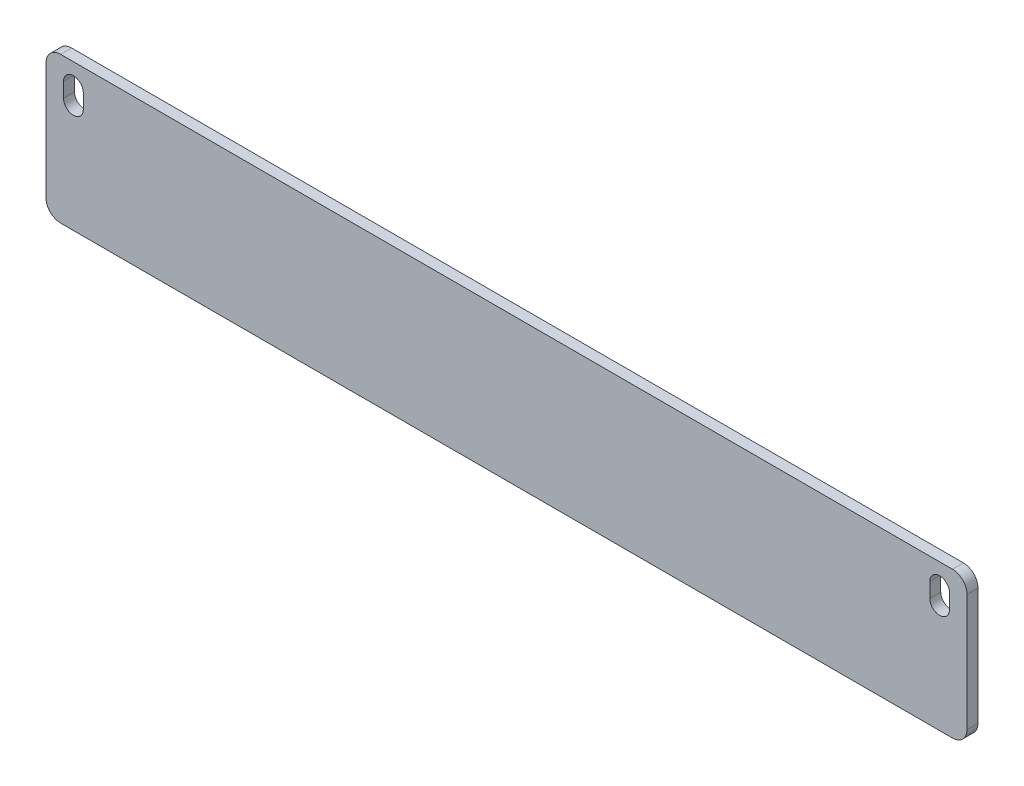
from build123d import *

# Parameters (mm, degrees)
SKETCH1_W           = 252
SKETCH1_H           = 40
BOSS_EXTRUDE1_DEPTH = 3
SKETCH2_W           = 220
SKETCH2_H           = 8
BOSS_EXTRUDE2_DEPTH = 5
FILLET1_R           = 4
FILLET2_R           = 1


with BuildPart() as part:
    # Sketch1 → Boss-Extrude1 (new body)
    with BuildSketch(Plane.XY):
        with Locations((126, 20)):
            Rectangle(SKETCH1_W, SKETCH1_H)
        with BuildLine():
            Line((10.2, 34), (10.2, 30))
            ThreePointArc((10.2, 30), (7.5, 27.3), (4.8, 30))
            Line((4.8, 30), (4.8, 34))
            ThreePointArc((4.8, 34), (7.5, 36.7), (10.2, 34))
        make_face(mode=Mode.SUBTRACT)
        with BuildLine():
            Line((247.2, 34), (247.2, 30))
            ThreePointArc((247.2, 30), (244.5, 27.3), (241.8, 30))
            Line((241.8, 30), (241.8, 34))
            ThreePointArc((241.8, 34), (244.5, 36.7), (247.2, 34))
        make_face(mode=Mode.SUBTRACT)
    extrude(amount=BOSS_EXTRUDE1_DEPTH)

    # Sketch2 → Boss-Extrude2 (add)
    with BuildSketch(Plane.XZ):
        with Locations((126, -4)):
            Rectangle(SKETCH2_W, SKETCH2_H)
    extrude(amount=-BOSS_EXTRUDE2_DEPTH)

    # Fillet1
    fillet1_edges = [part.edges().sort_by_distance(p)[0] for p in [
        (0, 40, 1.5),
        (252, 40, 1.5),
        (252, 0, 1.5),
        (0, 0, 1.5),
    ]]
    fillet(fillet1_edges, radius=FILLET1_R)

    # Fillet2
    fillet2_edges = [part.edges().sort_by_distance(p)[0] for p in [
        (126, 5, 0),
        (16, 2.5, 0),
        (236, 5, -4),
        (236, 2.5, 0),
        (126, 5, -8),
        (236, 2.5, -8),
        (16, 5, -4),
        (16, 2.5, -8),
    ]]
    fillet(fillet2_edges, radius=FILLET2_R)


solid = part.part
